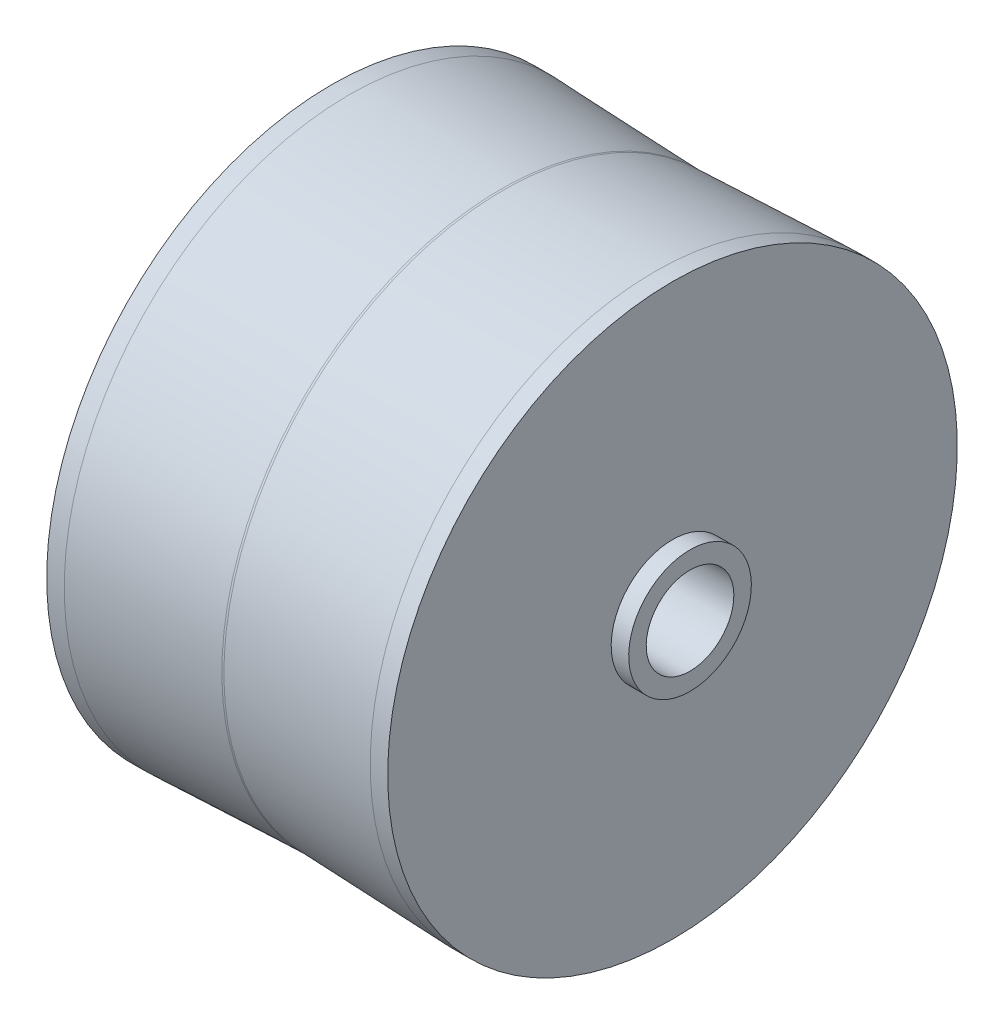
from build123d import *


with BuildPart() as part:
    # Sketch1 → Revolve1 (revolve)
    with BuildSketch(Plane.XY):
        with BuildLine():
            Line((-27.25, 6.35), (27.25, 6.35))
            Line((27.25, 6.35), (27.25, 8.89))
            Line((27.25, 8.89), (24.71, 8.89))
            Line((24.71, 8.89), (24.71, 41.275))
            Line((24.71, 41.275), (22.17, 41.275))
            Line((22.17, 41.275), (0.149248694, 40.452785366))
            ThreePointArc((0.149248694, 40.452785366), (0, 40.45), (-0.149248694, 40.452785366))
            Line((-0.149248694, 40.452785366), (-22.17, 41.275))
            Line((-22.17, 41.275), (-24.71, 41.275))
            Line((-24.71, 41.275), (-24.71, 8.89))
            Line((-24.71, 8.89), (-27.25, 8.89))
            Line((-27.25, 8.89), (-27.25, 6.35))
        make_face()
    revolve(axis=Axis((-27.25, 0, 0), (1, 0, 0)))


solid = part.part
